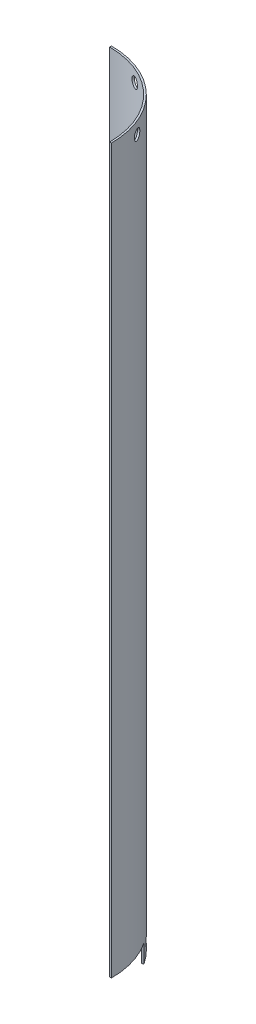
from build123d import *

# Parameters (mm, degrees)
BOSS_EXTRUDE1_DEPTH     = 812
CUT_EXTRUDE4_REACH      = 819.195
CUT_EXTRUDE4_END_RADIUS = 90
SKETCH6_R               = 5.565
CUT_EXTRUDE2_REACH      = 820.409
CUT_EXTRUDE2_END_RADIUS = 90
SKETCH3_R               = 5.565
CUT_EXTRUDE3_REACH      = 820.409
CUT_EXTRUDE3_END_RADIUS = 90
SKETCH5_R               = 5.565
LPATTERN2_COUNT         = 2
LPATTERN2_PITCH         = 789
CUT_EXTRUDE5_DEPTH      = 20


with BuildPart() as part:
    # Sketch1 → Boss-Extrude1 (new body)
    with BuildSketch(Plane(origin=(0, 0, 0), x_dir=(1, 0, 0), z_dir=(0, 1, 0))):
        with BuildLine():
            Line((0, 92), (0, 90))
            ThreePointArc((0, 90), (63.639610307, 63.639610307), (90, 0))
            Line((90, 0), (92, 0))
            ThreePointArc((92, 0), (65.053823869, 65.053823869), (0, 92))
        make_face()
    extrude(amount=BOSS_EXTRUDE1_DEPTH)

    # Cut-Extrude4: up to this cylinder (the profile starts outside it)
    cut_extrude4_end = Plane(origin=(0, 10, 0), z_dir=(0, -1, 0)) * Cylinder(CUT_EXTRUDE4_END_RADIUS, 1819.39, mode=Mode.PRIVATE)
    # Sketch6 → Cut-Extrude4 (cut, up to the surface)
    with BuildSketch(Plane(origin=(65.053823869, 0, -65.053823869), x_dir=(-0.7071067811865486, 0, -0.7071067811865465), z_dir=(0.7071067811865465, 0, -0.7071067811865486)), mode=Mode.PRIVATE) as cut_extrude4_sk1:
        with Locations((0, 10)):
            Circle(SKETCH6_R)
    cut_extrude4_tool1 = extrude(cut_extrude4_sk1.sketch, amount=-CUT_EXTRUDE4_REACH, mode=Mode.PRIVATE) - cut_extrude4_end
    add(cut_extrude4_tool1.solids().sort_by_distance((65.053824, 10, -65.053824))[0], mode=Mode.SUBTRACT)

    # Cut-Extrude2: up to this cylinder (the profile starts outside it)
    cut_extrude2_end = Plane(origin=(0, 10, 0), z_dir=(0, -1, 0)) * Cylinder(CUT_EXTRUDE2_END_RADIUS, 1821.818, mode=Mode.PRIVATE)
    # Sketch3 → Cut-Extrude2 (cut, up to the surface)
    with BuildSketch(Plane(origin=(84.996916991, 0, -35.206875778), x_dir=(-0.38268343236509045, 0, -0.9238795325112865), z_dir=(0.9238795325112865, 0, -0.38268343236509045)), mode=Mode.PRIVATE) as cut_extrude2_sk1:
        with Locations((0, 10)):
            Circle(SKETCH3_R)
    cut_extrude2_tool1 = extrude(cut_extrude2_sk1.sketch, amount=-CUT_EXTRUDE2_REACH, mode=Mode.PRIVATE) - cut_extrude2_end
    cut_extrude2 = cut_extrude2_tool1.solids().sort_by_distance((84.996917, 10, -35.206876))[0]
    add(cut_extrude2, mode=Mode.SUBTRACT)

    # Cut-Extrude3: up to this cylinder (the profile starts outside it)
    cut_extrude3_end = Plane(origin=(0, 10, 0), z_dir=(0, -1, 0)) * Cylinder(CUT_EXTRUDE3_END_RADIUS, 1821.818, mode=Mode.PRIVATE)
    # Sketch5 → Cut-Extrude3 (cut, up to the surface)
    with BuildSketch(Plane(origin=(35.206875778, 0, -84.996916991), x_dir=(-0.9238795325112878, 0, -0.3826834323650876), z_dir=(0.3826834323650876, 0, -0.9238795325112878)), mode=Mode.PRIVATE) as cut_extrude3_sk1:
        with Locations((0, 10)):
            Circle(SKETCH5_R)
    cut_extrude3_tool1 = extrude(cut_extrude3_sk1.sketch, amount=-CUT_EXTRUDE3_REACH, mode=Mode.PRIVATE) - cut_extrude3_end
    cut_extrude3 = cut_extrude3_tool1.solids().sort_by_distance((35.206876, 10, -84.996917))[0]
    add(cut_extrude3, mode=Mode.SUBTRACT)

    # LPattern2: Cut-Extrude2, Cut-Extrude3 ×2
    with Locations(*[(0, i * LPATTERN2_PITCH, 0) for i in range(1, LPATTERN2_COUNT)]):
        add(cut_extrude2, mode=Mode.SUBTRACT)
        add(cut_extrude3, mode=Mode.SUBTRACT)

    # Sketch7 → Cut-Extrude5 (cut)
    with BuildSketch(Plane.XZ):
        with BuildLine():
            ThreePointArc((90, 0), (86.112133982, -26.166780106), (74.784435976, -50.072828318))
            Line((74.784435976, -50.072828318), (76.447375943, -51.183969281))
            ThreePointArc((76.447375943, -51.183969281), (88.026014867, -26.747349525), (92, 0))
            Line((92, 0), (90, 0))
        make_face()
        with BuildLine():
            Line((51.183969281, -76.447375943), (50.072828318, -74.784435976))
            ThreePointArc((50.072828318, -74.784435976), (26.166780106, -86.112133982), (0, -90))
            Line((0, -90), (0, -92))
            ThreePointArc((0, -92), (26.747349525, -88.026014867), (51.183969281, -76.447375943))
        make_face()
    extrude(amount=-CUT_EXTRUDE5_DEPTH, mode=Mode.SUBTRACT)


solid = part.part
